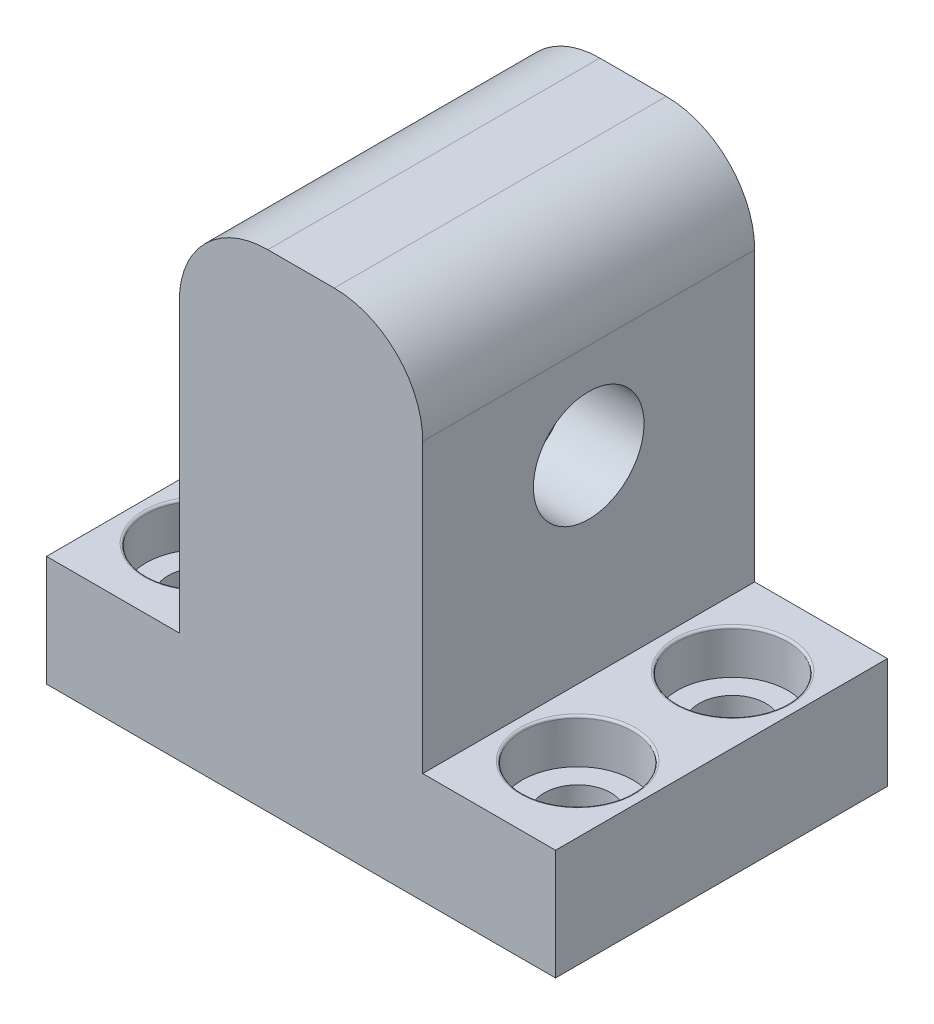
from build123d import *

# Parameters (mm, degrees)
SALIENTE_EXTRUIR1_DEPTH = 15
CROQUIS2_R              = 2.5
CORTAR_EXTRUIR1_DEPTH   = 3.5
CORTAR_EXTRUIR2_START   = -3.5
CROQUIS3_R              = 2.5
CORTAR_EXTRUIR2_DEPTH   = 3.5
CROQUIS4_R              = 2.5
CORTAR_EXTRUIR3_DEPTH   = 2
REDONDEO1_R             = 0.1
CROQUIS5_R              = 1.5
CORTAR_EXTRUIR4_DEPTH   = 26.421447638


with BuildPart() as part:
    # Croquis1 → Saliente-Extruir1 (new body)
    with BuildSketch(Plane.XY):
        with BuildLine():
            Line((-1.5, 11), (1.5, 11))
            ThreePointArc((1.5, 11), (4.328427125, 9.828427125), (5.5, 7))
            Line((5.5, 7), (5.5, -6))
            Line((5.5, -6), (11.5, -6))
            Line((11.5, -6), (11.5, -11))
            Line((11.5, -11), (5.5, -11))
            Line((5.5, -11), (-5.5, -11))
            Line((-5.5, -11), (-11.5, -11))
            Line((-11.5, -11), (-11.5, -6))
            Line((-11.5, -6), (-5.5, -6))
            Line((-5.5, -6), (-5.5, 7))
            ThreePointArc((-5.5, 7), (-4.328427125, 9.828427125), (-1.5, 11))
        make_face()
    extrude(amount=-SALIENTE_EXTRUIR1_DEPTH)

    # Croquis2 → Cortar-Extruir1 (cut)
    with BuildSketch(Plane(origin=(5.5, 0, 0), x_dir=(0, 0, -1), z_dir=(1, 0, 0))):
        with Locations(Location((7.5, 2.7, 0), (0, 0, 90))):
            Circle(CROQUIS2_R)
    extrude(amount=-CORTAR_EXTRUIR1_DEPTH, mode=Mode.SUBTRACT)

    # Croquis3 → Cortar-Extruir2 (cut)
    with BuildSketch(Plane.ZY.offset(5.5).offset(CORTAR_EXTRUIR2_START)):
        with Locations(Location((-7.5, 2.7, 0), (0, 0, 90))):
            Circle(CROQUIS3_R)
    extrude(amount=CORTAR_EXTRUIR2_DEPTH, mode=Mode.SUBTRACT)

    # Croquis4 → Cortar-Extruir3 (cut)
    with BuildSketch(Plane(origin=(0, -6, 0), x_dir=(1, 0, 0), z_dir=(0, 1, 0))):
        with Locations(Location((-8.5, 11, 0), (0, 0, 180))):
            Circle(CROQUIS4_R)
        with Locations(Location((-8.5, 4, 0), (0, 0, 180))):
            Circle(CROQUIS4_R)
        with Locations((8.5, 4)):
            Circle(CROQUIS4_R)
        with Locations((8.5, 11)):
            Circle(CROQUIS4_R)
    extrude(amount=-CORTAR_EXTRUIR3_DEPTH, mode=Mode.SUBTRACT)

    # Redondeo1
    redondeo1_edges = [part.edges().sort_by_distance(p)[0] for p in [
        (6, -6, -11),
        (6, -6, -4),
        (-6, -6, -4),
        (-6, -6, -11),
    ]]
    fillet(redondeo1_edges, radius=REDONDEO1_R)

    # Croquis5 → Cortar-Extruir4 (cut, through all)
    with BuildSketch(Plane(origin=(0, -6, 0), x_dir=(1, 0, 0), z_dir=(0, 1, 0))):
        with Locations(Location((-8.5, 11, 0), (0, 0, 180))):
            Circle(CROQUIS5_R)
        with Locations(Location((-8.5, 4, 0), (0, 0, 180))):
            Circle(CROQUIS5_R)
        with Locations((8.5, 4)):
            Circle(CROQUIS5_R)
        with Locations((8.5, 11)):
            Circle(CROQUIS5_R)
    extrude(amount=-CORTAR_EXTRUIR4_DEPTH, mode=Mode.SUBTRACT)


solid = part.part
